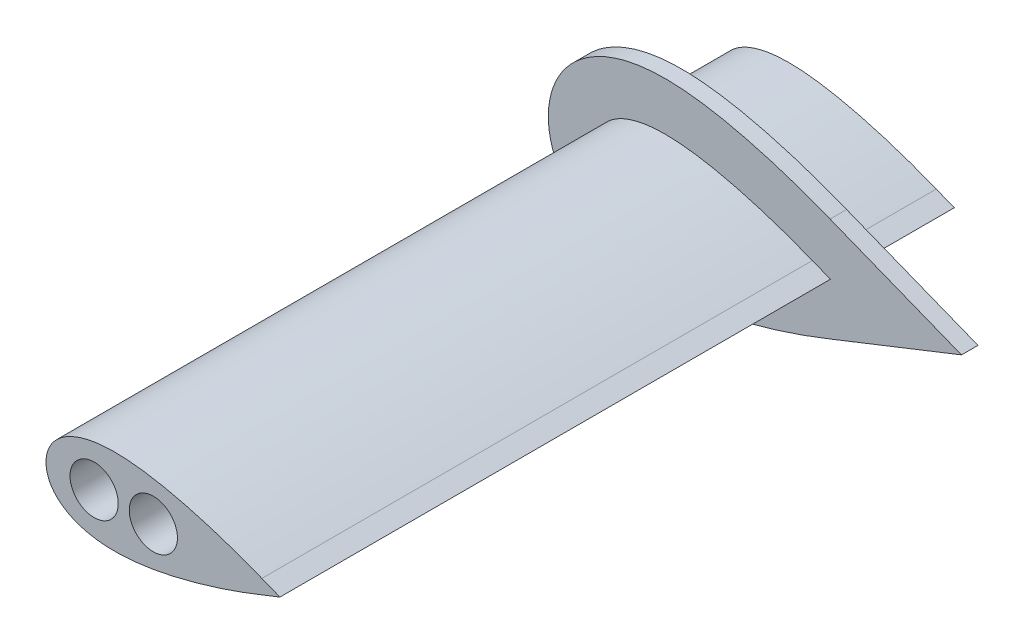
from build123d import *
from build123d.topology import SkipClean

# Parameters (mm, degrees)
SKETCH2_R           = 1.75
BOSS_EXTRUDE2_DEPTH = 40
BOSS_EXTRUDE3_DEPTH = 1.2
BOSS_EXTRUDE4_START = 9
SKETCH4_R           = 1.75
BOSS_EXTRUDE4_DEPTH = 9


with BuildPart() as part:
    # Sketch2 → Boss-Extrude2 (new body)
    with BuildSketch(Plane.XY):
        with BuildLine():
            Line((15.186280609, 0.519303809), (16.5, 0))
            Line((16.5, 0), (15.186280609, -0.519303809))
            add(Edge.make_bspline(
                [(15.186280609, 0.519303809), (13.887657986, 1.040653437), (11.907772652, 1.743943274), (9.202445725, 2.483066351), (7.134479372, 2.920074582), (5.009374964, 3.169715775), (3.185794853, 3.107352864), (1.723673782, 2.731751211), (0.673889654, 2.212010091), (-0.238159314, 1.325780466), (-0.630920343, 0), (-0.238159314, -1.325780466), (0.673889654, -2.212010091), (1.723673782, -2.731751211), (3.185794853, -3.107352864), (5.009374964, -3.169715775), (7.134479372, -2.920074582), (9.202445725, -2.483066351), (11.907772652, -1.743943274), (13.887657986, -1.040653437), (15.186280609, -0.519303809)],
                knots=[0, 0, 0, 0, 0.125, 0.1875, 0.25, 0.3125, 0.375, 0.40625, 0.4375, 0.46875, 0.5, 0.53125, 0.5625, 0.59375, 0.625, 0.6875, 0.75, 0.8125, 0.875, 1, 1, 1, 1], degree=3))
        make_face()
        with Locations((3, 0)):
            Circle(SKETCH2_R, mode=Mode.SUBTRACT)
        with Locations((7.3, 0)):
            Circle(SKETCH2_R, mode=Mode.SUBTRACT)
    extrude(amount=BOSS_EXTRUDE2_DEPTH)



with BuildPart() as body_2:
    # Sketch3 → Boss-Extrude3 (new body)
    with BuildSketch(Plane(origin=(0, 0, 0), x_dir=(-1, 0, 0), z_dir=(0, 0, -1))):
        with BuildLine():
            Line((-16.472928962, 3.774228695), (-26.0208609, 0))
            Line((-26.0208609, 0), (-16.490244872, -3.767330471))
            add(Edge.make_bspline(
                [(-16.490244872, -3.767330471), (-14.601834952, -4.525463253), (-12.68207529, -5.176857339), (-9.740956008, -5.94462386), (-8.750624401, -6.167112583), (-6.737864742, -6.500909271), (-5.727466843, -6.609647101), (-4.202170629, -6.632358032), (-3.6889784, -6.61511014), (-2.678026898, -6.518190741), (-2.179765755, -6.439376344), (-1.199884316, -6.211732944), (-0.718385297, -6.062393689), (-0.011765928, -5.772626767), (0.222496905, -5.66412388), (0.676287064, -5.426079636), (0.896008029, -5.29665729), (1.32063508, -5.016335651), (1.525617005, -4.865546302), (1.919735022, -4.540996094), (2.110047896, -4.365868906), (2.643936196, -3.812443022), (2.950105426, -3.40846785), (3.32968706, -2.74642203), (3.443581821, -2.514795533), (3.640495015, -2.039795539), (3.723001887, -1.798293556), (3.856963451, -1.307498207), (3.908413848, -1.058203764), (3.979088832, -0.551529018), (3.998147188, -0.29249395), (4.003031625, 0.475234942), (3.938957199, 0.980097947), (3.74524897, 1.727309289), (3.66463116, 1.972208707), (3.474993928, 2.44583291), (3.36565243, 2.675853523), (3.117482498, 3.122105459), (2.977456364, 3.339622932), (2.672504217, 3.753185023), (2.508289418, 3.948762742), (2.15811427, 4.319164435), (1.972145466, 4.49398034), (1.579541609, 4.823888481), (1.372555276, 4.979068475), (0.735358449, 5.407431095), (0.284510693, 5.646701574), (-0.426260872, 5.944282402), (-0.668065833, 6.032911428), (-1.153929741, 6.188920214), (-1.398990984, 6.256644207), (-2.139897377, 6.432186634), (-2.641317523, 6.513088481), (-3.656911007, 6.613318598), (-4.171439452, 6.631708122), (-5.697154298, 6.611931242), (-6.703982036, 6.504864682), (-8.705041856, 6.176097685), (-9.701779392, 5.953840162), (-12.65655271, 5.185262791), (-14.581665644, 4.532757165), (-16.472928962, 3.774228695)],
                knots=[0, 0, 0, 0, 0.125, 0.125, 0.1875, 0.1875, 0.25, 0.25, 0.28125, 0.28125, 0.3125, 0.3125, 0.34375, 0.34375, 0.359375, 0.359375, 0.375, 0.375, 0.390625, 0.390625, 0.40625, 0.40625, 0.4375, 0.4375, 0.453125, 0.453125, 0.46875, 0.46875, 0.484375, 0.484375, 0.5, 0.5, 0.53125, 0.53125, 0.546875, 0.546875, 0.5625, 0.5625, 0.578125, 0.578125, 0.59375, 0.59375, 0.609375, 0.609375, 0.625, 0.625, 0.65625, 0.65625, 0.671875, 0.671875, 0.6875, 0.6875, 0.71875, 0.71875, 0.75, 0.75, 0.8125, 0.8125, 0.875, 0.875, 1, 1, 1, 1], degree=3))
        make_face()
        with BuildLine():
            Line((-16.5, 0), (-15.186280609, -0.519303809))
            add(Edge.make_bspline(
                [(-15.186280609, -0.519303809), (-13.887657986, -1.040653437), (-11.907772652, -1.743943274), (-9.202445725, -2.483066351), (-7.134479372, -2.920074582), (-5.009374964, -3.169715775), (-3.185794853, -3.107352864), (-1.723673782, -2.731751211), (-0.673889654, -2.212010091), (0.238159314, -1.325780466), (0.630920343, 0), (0.238159314, 1.325780466), (-0.673889654, 2.212010091), (-1.723673782, 2.731751211), (-3.185794853, 3.107352864), (-5.009374964, 3.169715775), (-7.134479372, 2.920074582), (-9.202445725, 2.483066351), (-11.907772652, 1.743943274), (-13.887657986, 1.040653437), (-15.186280609, 0.519303809)],
                knots=[0, 0, 0, 0, 0.125, 0.1875, 0.25, 0.3125, 0.375, 0.40625, 0.4375, 0.46875, 0.5, 0.53125, 0.5625, 0.59375, 0.625, 0.6875, 0.75, 0.8125, 0.875, 1, 1, 1, 1], degree=3))
            Line((-15.186280609, 0.519303809), (-16.5, 0))
        make_face(mode=Mode.SUBTRACT)
    extrude(amount=BOSS_EXTRUDE3_DEPTH)


with BuildPart() as part_1:
    with SkipClean():  # the faces are left unmerged after this step: merging them gives an invalid solid
        add(part.part)

        add(body_2.part)  # Boss-Extrude4 merges body 2
        # Sketch4 → Boss-Extrude4 (add)
        with BuildSketch(Plane(origin=(0, 0, 0), x_dir=(-1, 0, 0), z_dir=(0, 0, -1)).offset(BOSS_EXTRUDE4_START)):
            with BuildLine():
                Line((-16.5, 0), (-15.186280609, 0.519303809))
                add(Edge.make_bspline(
                    [(-15.186280609, 0.519303809), (-13.887657986, 1.040653437), (-11.907772652, 1.743943274), (-9.202445725, 2.483066351), (-7.134479372, 2.920074582), (-5.009374964, 3.169715775), (-3.185794853, 3.107352864), (-1.723673782, 2.731751211), (-0.673889654, 2.212010091), (0.238159314, 1.325780466), (0.630920343, 0), (0.238159314, -1.325780466), (-0.673889654, -2.212010091), (-1.723673782, -2.731751211), (-3.185794853, -3.107352864), (-5.009374964, -3.169715775), (-7.134479372, -2.920074582), (-9.202445725, -2.483066351), (-11.907772652, -1.743943274), (-13.887657986, -1.040653437), (-15.186280609, -0.519303809)],
                    knots=[0, 0, 0, 0, 0.125, 0.1875, 0.25, 0.3125, 0.375, 0.40625, 0.4375, 0.46875, 0.5, 0.53125, 0.5625, 0.59375, 0.625, 0.6875, 0.75, 0.8125, 0.875, 1, 1, 1, 1], degree=3))
                Line((-15.186280609, -0.519303809), (-16.5, 0))
            make_face()
            with Locations((-7.3, 0)):
                Circle(SKETCH4_R, mode=Mode.SUBTRACT)
            with Locations((-3, 0)):
                Circle(SKETCH4_R, mode=Mode.SUBTRACT)
        extrude(amount=-BOSS_EXTRUDE4_DEPTH)


solid = part_1.part
